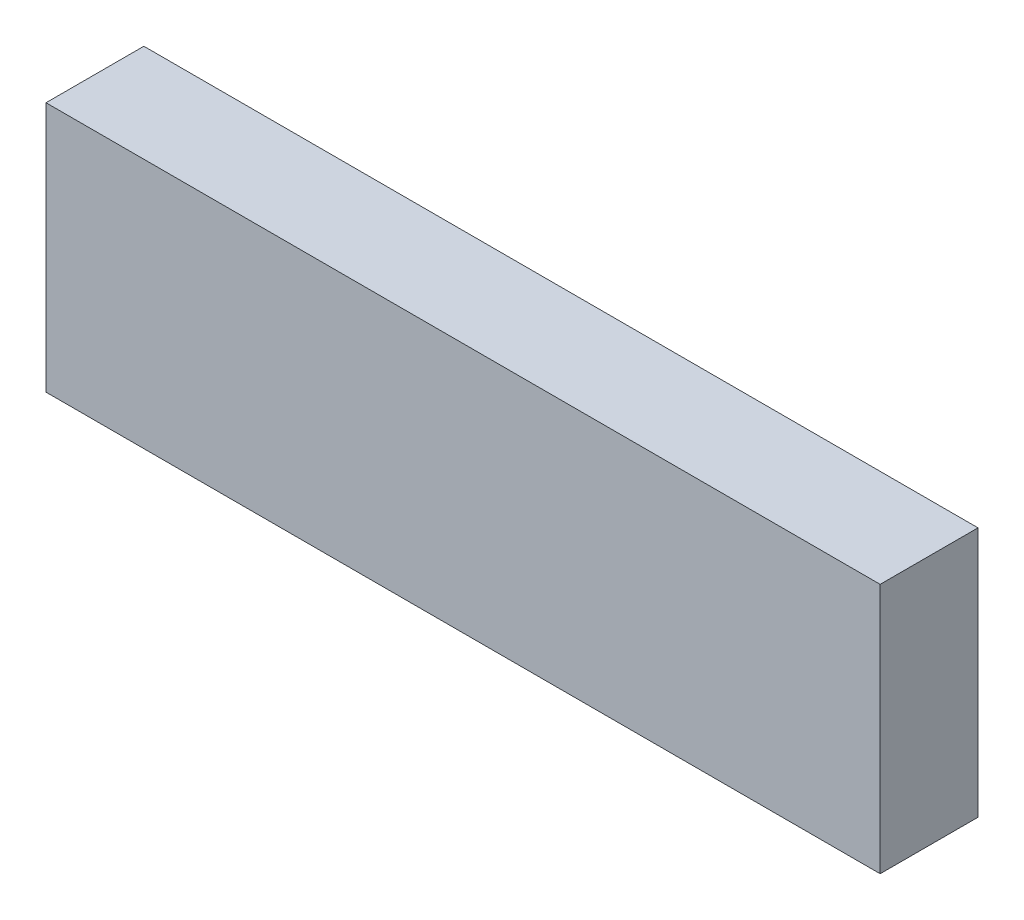
from build123d import *

# Parameters (mm, degrees)
SKETCH1_W           = 40.6
SKETCH1_H           = 12.2
BOSS_EXTRUDE1_DEPTH = 4.7625


with BuildPart() as part:
    # Sketch1 → Boss-Extrude1 (new body)
    with BuildSketch(Plane.XY):
        with Locations((0, 6.1)):
            Rectangle(SKETCH1_W, SKETCH1_H)
    extrude(amount=BOSS_EXTRUDE1_DEPTH)


solid = part.part
